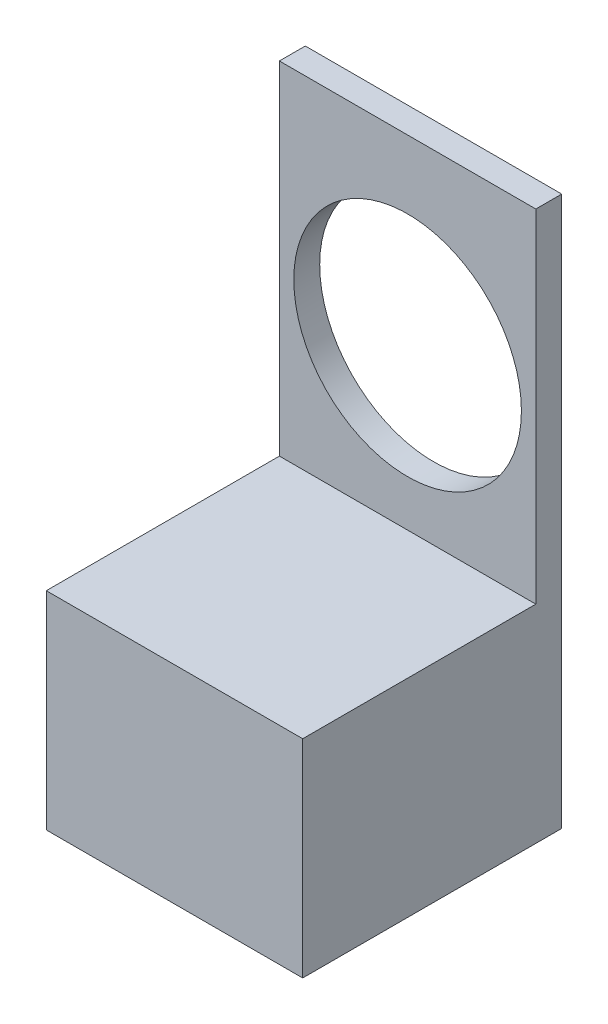
from build123d import *

# Parameters (mm, degrees)
SKETCH1_W           = 25.146
SKETCH1_H           = 22.86
BOSS_EXTRUDE1_DEPTH = 20.32
SKETCH2_W           = 25.146
SKETCH2_H           = 53.877304538
BOSS_EXTRUDE2_DEPTH = 2.54
SKETCH4_R           = 11.159783479
CUT_EXTRUDE1_DEPTH  = 2.54


with BuildPart() as part:
    # Sketch1 → Boss-Extrude1 (new body)
    with BuildSketch(Plane(origin=(0, 0, 0), x_dir=(1, 0, 0), z_dir=(0, 1, 0))):
        with Locations((12.573, 11.43)):
            Rectangle(SKETCH1_W, SKETCH1_H)
    extrude(amount=BOSS_EXTRUDE1_DEPTH)

    # Sketch2 → Boss-Extrude2 (add)
    with BuildSketch(Plane(origin=(0, 0, -22.86), x_dir=(-1, 0, 0), z_dir=(0, 0, -1))):
        with Locations((-12.573, 26.938652269)):
            Rectangle(SKETCH2_W, SKETCH2_H)
    extrude(amount=BOSS_EXTRUDE2_DEPTH)

    # Sketch4 → Cut-Extrude1 (cut)
    with BuildSketch(Plane(origin=(0, 0, -25.4), x_dir=(-1, 0, 0), z_dir=(0, 0, -1))):
        with Locations((-12.573, 36.017066526)):
            Circle(SKETCH4_R)
    extrude(amount=-CUT_EXTRUDE1_DEPTH, mode=Mode.SUBTRACT)


solid = part.part
